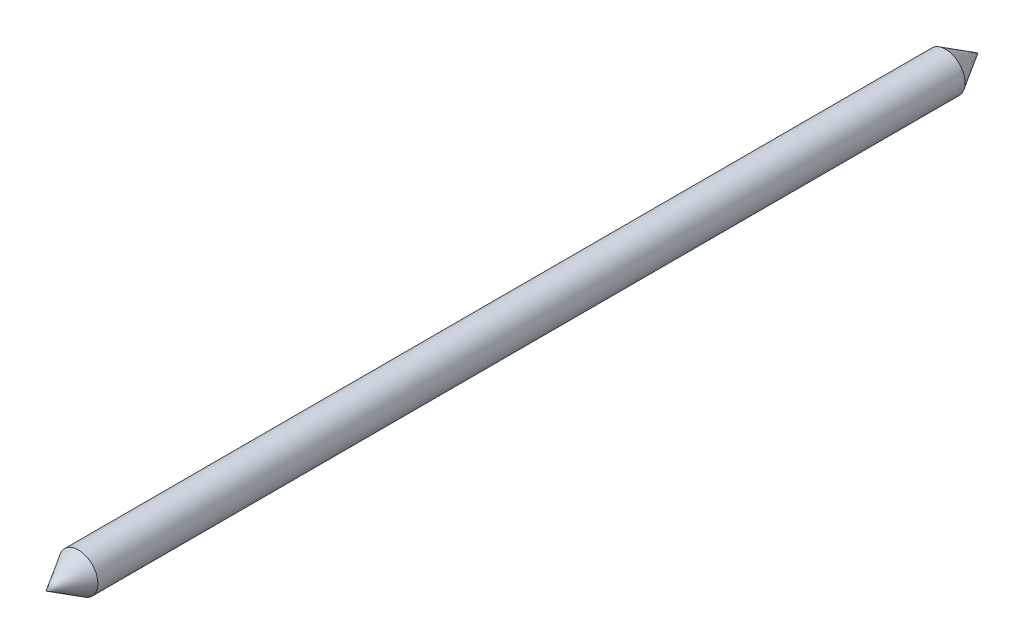
from build123d import *


with BuildPart() as part:
    # Sketch1 → Revolve1 (revolve)
    with BuildSketch(Plane(origin=(0, 0, 0), x_dir=(1, 0, 0), z_dir=(0, 1, 0)), mode=Mode.PRIVATE) as revolve1_sk:
        Polygon((0, 182.5625), (0, -182.5625), (7.62, -169.8625), (7.62, 169.8625), align=None)
    revolve(revolve1_sk.sketch.rotate(Axis((0, 0, -182.5625), (0, 0, 1)), 180), axis=Axis((0, 0, -182.5625), (0, 0, 1)))


solid = part.part
